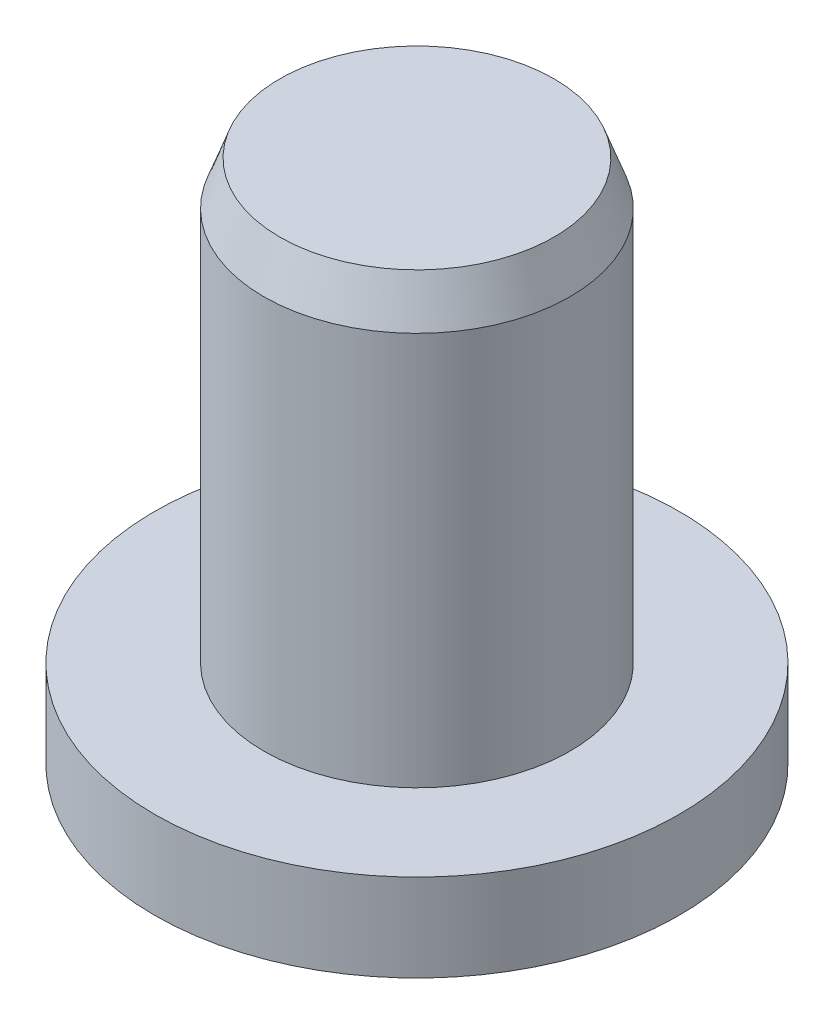
from build123d import *

# Parameters (mm, degrees)
SKETCH1_R           = 6
BOSS_EXTRUDE1_DEPTH = 2
SKETCH2_R           = 3.5
BOSS_EXTRUDE2_DEPTH = 10
CHAMFER1_SIZE       = 1
CHAMFER1_SIZE2      = 0.363970234


with BuildPart() as part:
    # Sketch1 → Boss-Extrude1 (new body)
    with BuildSketch(Plane(origin=(0, 0, 0), x_dir=(1, 0, 0), z_dir=(0, 1, 0))):
        with Locations(Location((0, 0, 0), (0, 0, 270))):
            Circle(SKETCH1_R)
    extrude(amount=BOSS_EXTRUDE1_DEPTH)

    # Sketch2 → Boss-Extrude2 (add)
    with BuildSketch(Plane(origin=(0, 2, 0), x_dir=(1, 0, 0), z_dir=(0, 1, 0))):
        with Locations(Location((0, 0, 0), (0, 0, 270))):
            Circle(SKETCH2_R)
    extrude(amount=BOSS_EXTRUDE2_DEPTH)

    # Chamfer1
    chamfer1_edges = [part.edges().sort_by_distance(p)[0] for p in [
        (0, 12, -3.5),
    ]]
    chamfer1_side = [part.faces().sort_by_distance(p)[0] for p in [
        (0, 7, -3.5),
    ]]
    chamfer(chamfer1_edges, length=CHAMFER1_SIZE, length2=CHAMFER1_SIZE2, reference=chamfer1_side[0])


solid = part.part
